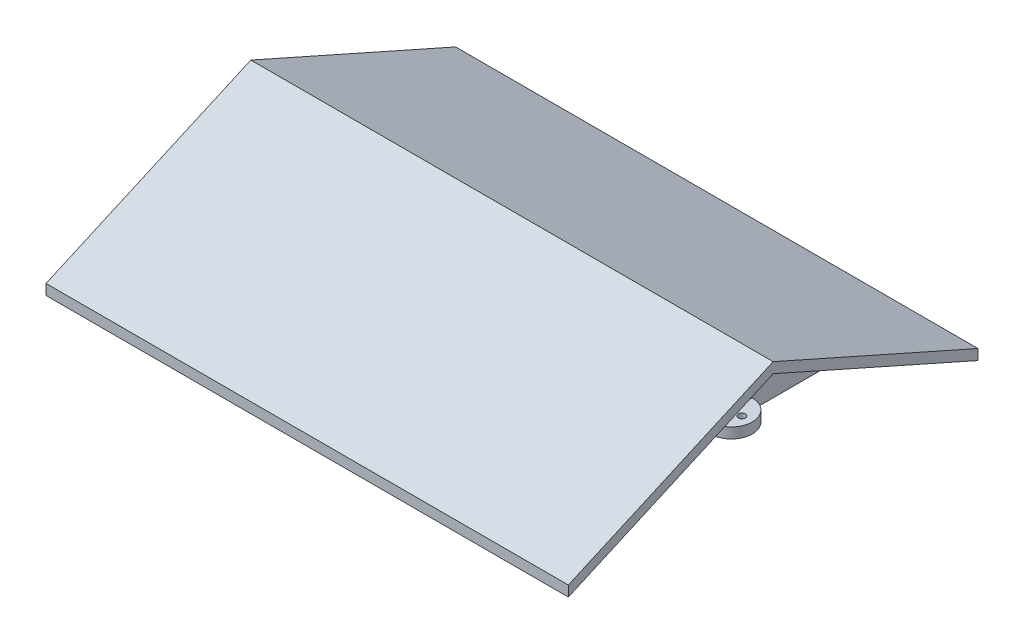
from build123d import *

# Parameters (mm, degrees)
BOSS_EXTRUDE2_DEPTH = 250
BOSS_EXTRUDE3_DEPTH = 25
CUT_EXTRUDE1_DEPTH  = 20
BOSS_EXTRUDE4_DEPTH = 25
CUT_EXTRUDE2_DEPTH  = 20
SKETCH6_R           = 10
BOSS_EXTRUDE5_DEPTH = 5


with BuildPart() as part:
    # Sketch1 → Boss-Extrude2 (new body)
    with BuildSketch(Plane(origin=(0, 0, 0), x_dir=(0, 0, -1), z_dir=(1, 0, 0))):
        Polygon((-30.524745156, -13.566553403), (0, 0), (67.5, 30), (135, 0), (165.524745156, -13.566553403), (165.524745156, -8.565955709), (67.5, 35.000597694), (-30.524745156, -8.565955709), align=None)
    extrude(amount=-BOSS_EXTRUDE2_DEPTH)

    # Sketch2 → Boss-Extrude3 (add)
    with BuildSketch(Plane(origin=(0, 0, 0), x_dir=(0, 0, -1), z_dir=(1, 0, 0))):
        Polygon((0, 0), (135, 0), (67.5, 30), align=None)
    extrude(amount=-BOSS_EXTRUDE3_DEPTH)

    # Sketch3 → Cut-Extrude1 (cut)
    with BuildSketch(Plane(origin=(0, 0, 0), x_dir=(0, 0, -1), z_dir=(1, 0, 0))):
        Polygon((0, 0), (135, 0), (67.5, 30), align=None)
    extrude(amount=-CUT_EXTRUDE1_DEPTH, mode=Mode.SUBTRACT)

    # Sketch4 → Boss-Extrude4 (add)
    with BuildSketch(Plane.ZY.offset(250)):
        Polygon((0, 0), (-135, 0), (-67.5, 30), align=None)
    extrude(amount=-BOSS_EXTRUDE4_DEPTH)

    # Sketch5 → Cut-Extrude2 (cut)
    with BuildSketch(Plane.ZY.offset(250)):
        Polygon((-135, 0), (0, 0), (-67.5, 30), align=None)
    extrude(amount=-CUT_EXTRUDE2_DEPTH, mode=Mode.SUBTRACT)

    # Sketch6 → Boss-Extrude5 (add)
    # profile 1 of 2: a face of its own
    with BuildSketch(Plane(origin=(0, 0, 0), x_dir=(-1, 0, 0), z_dir=(0, -1, 0))):
        with Locations((230, 67.5)):
            Circle(SKETCH6_R)
        with BuildLine():
            ThreePointArc((233.3, 67.5), (235, 69.2), (236.7, 67.5))
            ThreePointArc((236.7, 67.5), (235, 65.8), (233.3, 67.5))
        make_face(mode=Mode.SUBTRACT)
    # profile 2 of 2: a face of its own
    with BuildSketch(Plane(origin=(0, 0, 0), x_dir=(-1, 0, 0), z_dir=(0, -1, 0))):
        with Locations((20, 67.5)):
            Circle(SKETCH6_R)
        with BuildLine():
            ThreePointArc((13.3, 67.5), (15, 69.2), (16.7, 67.5))
            ThreePointArc((16.7, 67.5), (15, 65.8), (13.3, 67.5))
        make_face(mode=Mode.SUBTRACT)
    extrude(amount=-BOSS_EXTRUDE5_DEPTH)


solid = part.part
